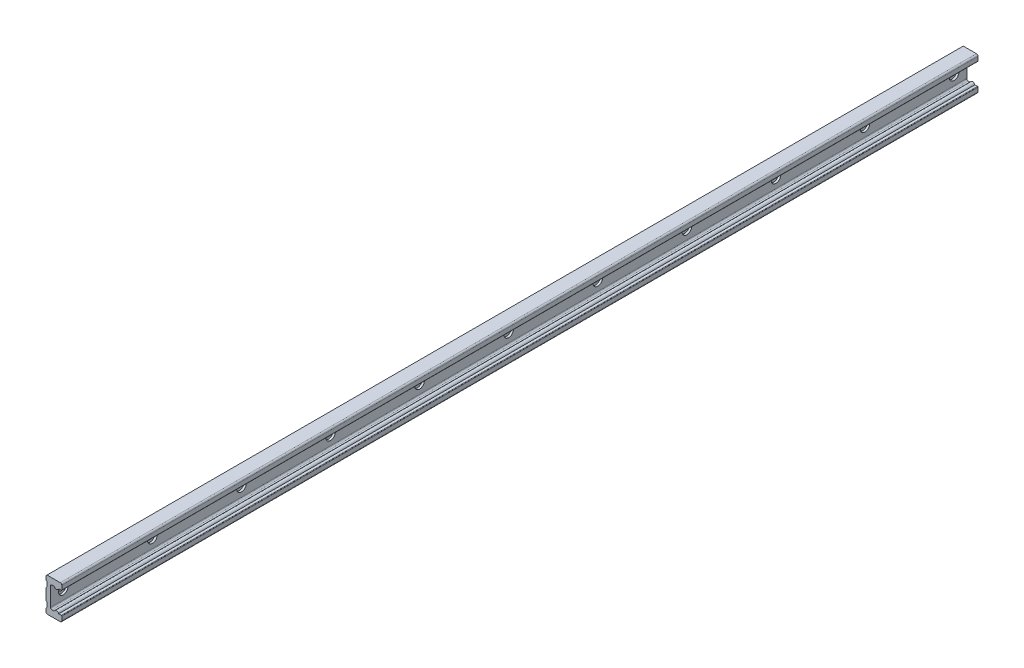
from build123d import *

# Parameters (mm, degrees)
BOSS_EXTRUDE1_DEPTH = 457.2
LPATTERN1_COUNT     = 11
LPATTERN1_PITCH     = 88.9


with BuildPart() as part:
    # Sketch1 → Boss-Extrude1 (new, symmetric)
    with BuildSketch(Plane.XY):
        with BuildLine():
            Line((5.334, 11.303), (5.334, 15.367))
            ThreePointArc((5.334, 15.367), (4.887630735, 16.444630735), (3.81, 16.891))
            Line((3.81, 16.891), (-9.398, 16.891))
            Line((-9.398, 16.891), (-10.414, 15.875))
            Line((-10.414, 15.875), (-10.414, 12.191998878))
            Line((-10.414, 12.191998878), (-9.652, 11.429999439))
            Line((-9.652, 11.429999439), (-9.652, 6.349999439))
            Line((-9.652, 6.349999439), (-10.414, 5.588))
            Line((-10.414, 5.588), (-10.414, -5.588))
            Line((-10.414, -5.588), (-9.652, -6.349999439))
            Line((-9.652, -6.349999439), (-9.652, -11.429999439))
            Line((-9.652, -11.429999439), (-10.414, -12.191998878))
            Line((-10.414, -12.191998878), (-10.414, -15.875))
            Line((-10.414, -15.875), (-9.398, -16.891))
            Line((-9.398, -16.891), (3.81, -16.891))
            ThreePointArc((3.81, -16.891), (4.887630735, -16.444630735), (5.334, -15.367))
            Line((5.334, -15.367), (5.334, -11.303))
            ThreePointArc((5.334, -11.303), (5.185210245, -10.943789755), (4.826, -10.795))
            Line((4.826, -10.795), (2.262739437, -10.795))
            ThreePointArc((2.262739437, -10.795), (0, -9.1694), (-2.262739437, -10.795))
            Line((-2.262739437, -10.795), (-4.318, -10.795))
            ThreePointArc((-4.318, -10.795), (-5.395630735, -10.348630735), (-5.842, -9.271))
            Line((-5.842, -9.271), (-5.842, 9.271))
            ThreePointArc((-5.842, 9.271), (-5.395630735, 10.348630735), (-4.318, 10.795))
            Line((-4.318, 10.795), (-2.262739437, 10.795))
            ThreePointArc((-2.262739437, 10.795), (0, 9.1694), (2.262739437, 10.795))
            Line((2.262739437, 10.795), (4.826, 10.795))
            ThreePointArc((4.826, 10.795), (5.185210245, 10.943789755), (5.334, 11.303))
        make_face()
    extrude(amount=BOSS_EXTRUDE1_DEPTH, both=True)

    # Sketch3 → Cut-Revolve1 (revolve, cut)
    with BuildSketch(Plane.XY.offset(444.5), mode=Mode.PRIVATE) as cut_revolve1_sk:
        Polygon((-5.842, 4.7625), (-8.0518, 4.7625), (-8.0518, 2.4638), (-10.414, 2.4638), (-10.414, 0), (-5.842, 0), align=None)
    cut_revolve1 = revolve(cut_revolve1_sk.sketch.rotate(Axis((-10.414, 0, 444.5), (1, 0, 0)), 180), axis=Axis((-10.414, 0, 444.5), (1, 0, 0)), mode=Mode.SUBTRACT)

    # LPattern1: Cut-Revolve1 ×11
    with Locations(*[(0, 0, -i * LPATTERN1_PITCH) for i in range(1, LPATTERN1_COUNT)]):
        add(cut_revolve1, mode=Mode.SUBTRACT)


solid = part.part
